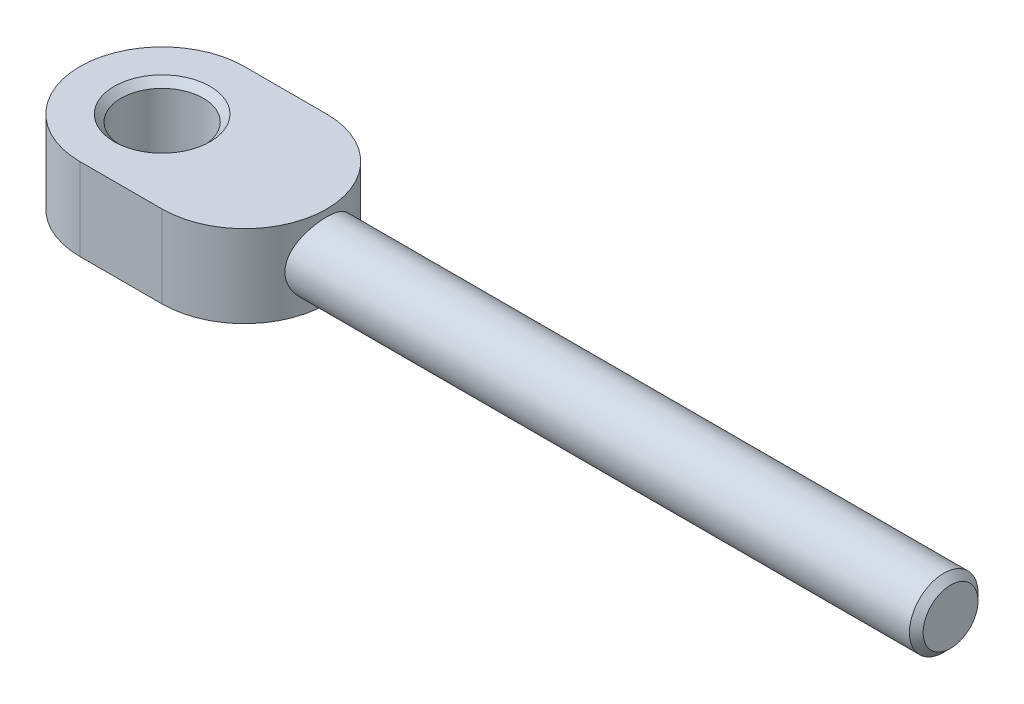
from build123d import *

# Parameters (mm, degrees)
SCHIZZO1_R                   = 5
ESTRUSIONE_ESTRUSIONE1_DEPTH = 115
ESTRUSIONE_ESTRUSIONE2_DEPTH = 6
TAGLIO_ESTRUSIONE1_REACH     = 118.245
SCHIZZO3_R                   = 6
SMUSSO1_SIZE                 = 1


with BuildPart() as part:
    # Schizzo1 → Estrusione-Estrusione1 (new body)
    with BuildSketch(Plane(origin=(0, 0, 0), x_dir=(0, 0, -1), z_dir=(1, 0, 0))):
        Circle(SCHIZZO1_R)
    extrude(amount=ESTRUSIONE_ESTRUSIONE1_DEPTH)

    # Schizzo2 → Estrusione-Estrusione2 (add, symmetric)
    with BuildSketch(Plane(origin=(0, 0, 0), x_dir=(1, 0, 0), z_dir=(0, 1, 0))):
        with BuildLine():
            Line((0, 12), (12, 12))
            ThreePointArc((12, 12), (24, 0), (12, -12))
            Line((12, -12), (0, -12))
            ThreePointArc((0, -12), (-12, 0), (0, 12))
        make_face()
    extrude(amount=ESTRUSIONE_ESTRUSIONE2_DEPTH, both=True)

    # Schizzo3 → Taglio-Estrusione1 (cut, up to next)
    with BuildSketch(Plane(origin=(0, 6, 0), x_dir=(1, 0, 0), z_dir=(0, 1, 0)), mode=Mode.PRIVATE) as taglio_estrusione1_sk1:
        with Locations(Location((0, 0, 0), (0, 0, 270))):
            Circle(SCHIZZO3_R)
    taglio_estrusione1_tool1 = extrude(taglio_estrusione1_sk1.sketch, amount=-TAGLIO_ESTRUSIONE1_REACH, mode=Mode.PRIVATE) & part.part
    add(taglio_estrusione1_tool1.solids().sort_by_distance((0, 6, 0))[0], mode=Mode.SUBTRACT)

    # Smusso1
    smusso1_edges = [part.edges().sort_by_distance(p)[0] for p in [
        (0, 6, -6),
        (0, -6, -6),
        (115, 0, 5),
    ]]
    chamfer(smusso1_edges, length=SMUSSO1_SIZE)


solid = part.part
